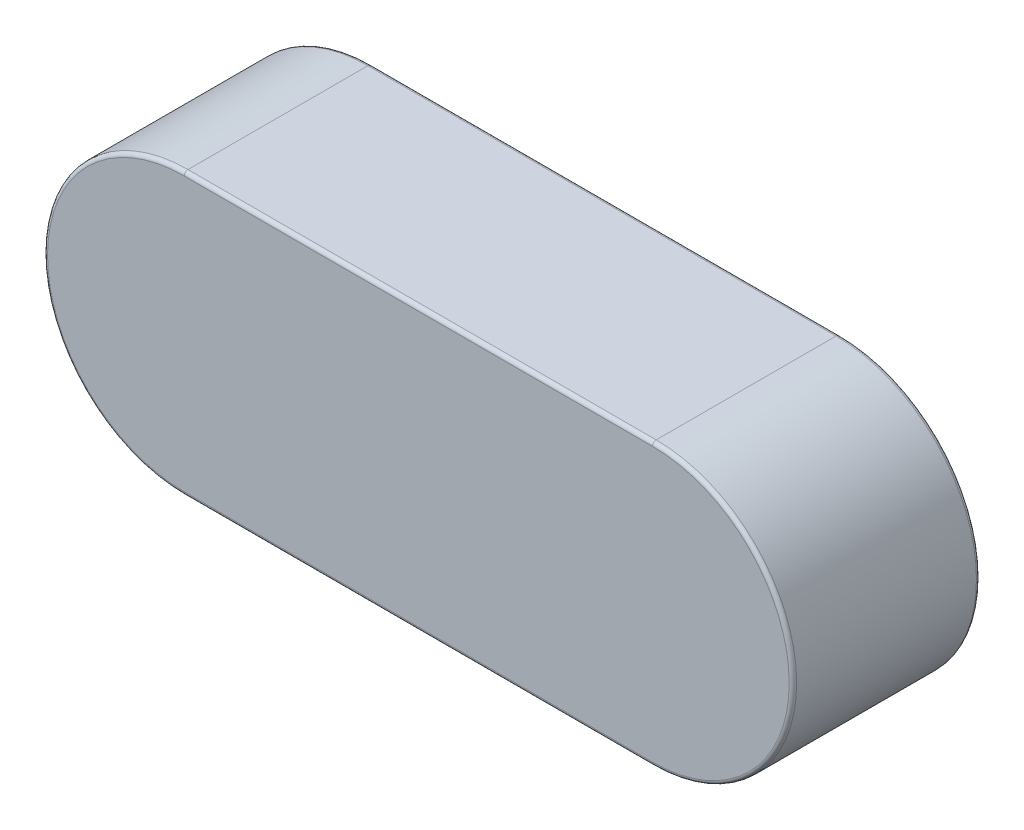
from build123d import *

# Parameters (mm, degrees)
EXTRUDE_1_DEPTH = 8
FILLET_1_R      = 0.16


with BuildPart() as part:
    # Эскиз1 → Бобышка-Вытянуть1 (new body)
    with BuildSketch(Plane.XY):
        with BuildLine():
            Line((0, 6), (20, 6))
            ThreePointArc((20, 6), (26, 0), (20, -6))
            Line((20, -6), (0, -6))
            ThreePointArc((0, -6), (-6, 0), (0, 6))
        make_face()
    extrude(amount=EXTRUDE_1_DEPTH)

    # Скругление1
    fillet_1_edges = [part.edges().sort_by_distance(p)[0] for p in [
        (26, 0, 8),
        (10, 6, 8),
        (-6, 0, 8),
        (10, 6, 0),
        (26, 0, 0),
        (10, -6, 0),
        (-6, 0, 0),
        (10, -6, 8),
    ]]
    fillet(fillet_1_edges, radius=FILLET_1_R)


solid = part.part
